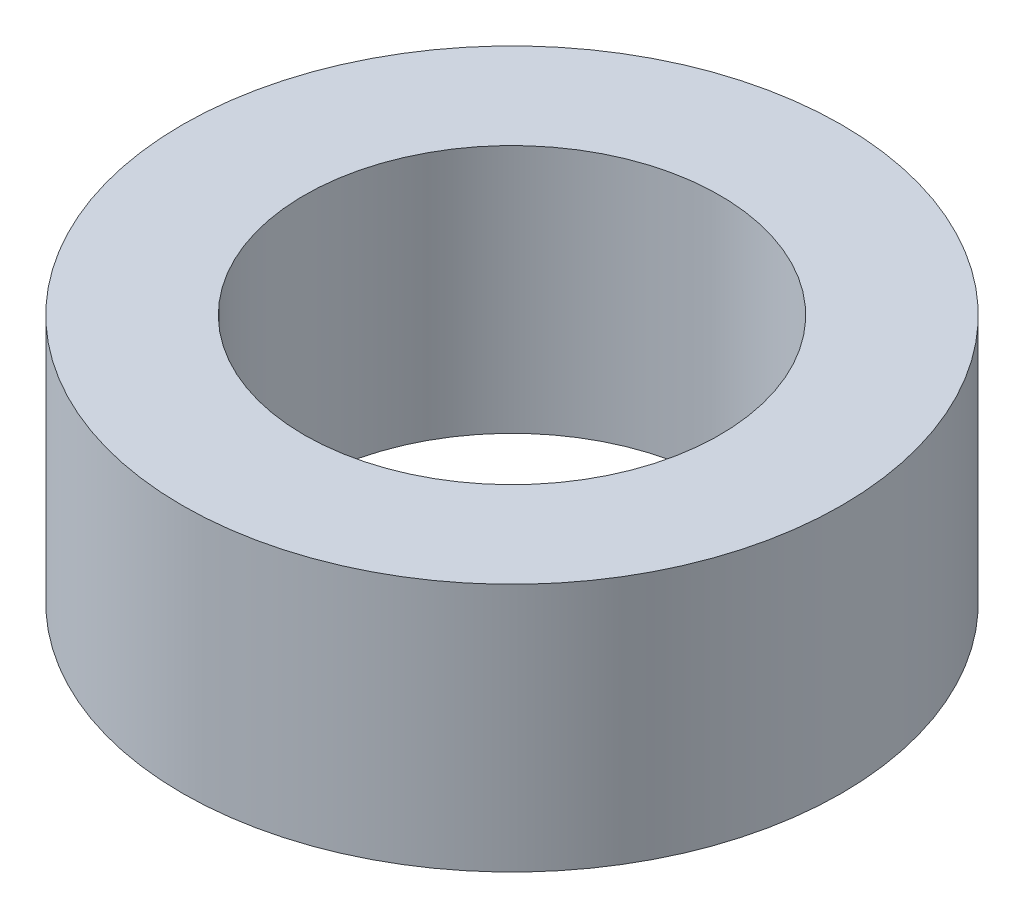
from build123d import *

# Parameters (mm, degrees)
SKETCH1_R           = 6.35
BOSS_EXTRUDE1_DEPTH = 4.8
SKETCH3_R           = 4
CUT_EXTRUDE2_DEPTH  = 11.182583169


with BuildPart() as part:
    # Sketch1 → Boss-Extrude1 (new body)
    with BuildSketch(Plane(origin=(0, 0, 0), x_dir=(1, 0, 0), z_dir=(0, 1, 0))):
        with Locations(Location((0, 0, 0), (0, 0, 270))):
            Circle(SKETCH1_R)
    extrude(amount=BOSS_EXTRUDE1_DEPTH)

    # Sketch3 → Cut-Extrude2 (cut, through all)
    with BuildSketch(Plane(origin=(0, 4.8, 0), x_dir=(1, 0, 0), z_dir=(0, 1, 0))):
        with Locations(Location((0, 0, 0), (0, 0, 270))):
            Circle(SKETCH3_R)
    extrude(amount=-CUT_EXTRUDE2_DEPTH, mode=Mode.SUBTRACT)


solid = part.part
